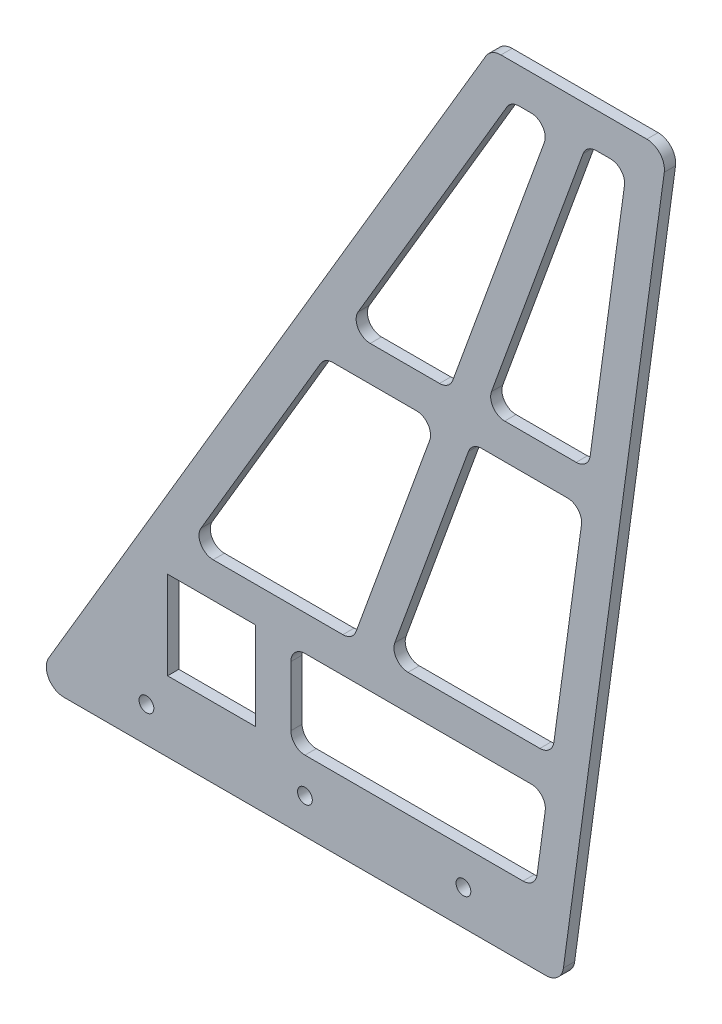
from build123d import *

# Parameters (mm, degrees)
EXTRUDE_1_DEPTH            = 3.2
FILLET_1_R                 = 5
SKETCH_2_R                 = 2.1
CUT_EXTRUDE_1_DEPTH        = 3.2
PATTERN_LINEAR_1_COUNT     = 2
PATTERN_LINEAR_1_PITCH     = 45
PATTERN_LINEAR_1_COL_COUNT = 2
PATTERN_LINEAR_1_COL_PITCH = 45
EXTRUDE_2_DEPTH            = 3.2
FILLET_2_R                 = 4


with BuildPart() as part:
    # Эскиз1 → Бобышка-Вытянуть1 (new body)
    with BuildSketch(Plane.XY):
        Polygon((0, 0), (150, 0), (180, 220), (130, 220), align=None)
        Polygon((135.706302127, 210), (23.433574854, 20), (142.634725768, 20), (168.543816677, 210), align=None, mode=Mode.SUBTRACT)
    extrude(amount=EXTRUDE_1_DEPTH)

    # Скругление1
    fillet_1_edges = [part.edges().sort_by_distance(p)[0] for p in [
        (130, 220, 1.6),
        (180, 220, 1.6),
        (150, 0, 1.6),
        (0, 0, 1.6),
    ]]
    fillet(fillet_1_edges, radius=FILLET_1_R)

    # Эскиз2 → Вырез-Вытянуть1 (cut)
    with BuildSketch(Plane.XY.offset(3.2)):
        with Locations((77.198893337, 10)):
            Circle(SKETCH_2_R)
    cut_extrude_1 = extrude(amount=-CUT_EXTRUDE_1_DEPTH, mode=Mode.SUBTRACT)

    # Линейный массив1: Вырез-Вытянуть1 ×2
    with Locations(*[(i * PATTERN_LINEAR_1_PITCH, 0, 0) for i in range(1, PATTERN_LINEAR_1_COUNT)]):
        add(cut_extrude_1, mode=Mode.SUBTRACT)

    # Линейный массив1 col: Вырез-Вытянуть1 ×2
    with Locations(*[(-i * PATTERN_LINEAR_1_COL_PITCH, 0, 0) for i in range(1, PATTERN_LINEAR_1_COL_COUNT)]):
        add(cut_extrude_1, mode=Mode.SUBTRACT)

    # Эскиз4 → Бобышка-Вытянуть2 (add)
    with BuildSketch(Plane.XY):
        Polygon((44.115393036, 55), (38.206302127, 45), (63.206302127, 45), (63.206302127, 20), (73.206302127, 20), (73.206302127, 45), (92.125059402, 45), (152.125059402, 210), (147.125059402, 210), (118.215968493, 130.5), (88.729029399, 130.5), (82.81993849, 120.5), (114.579604856, 120.5), (90.761423038, 55), align=None)
        Polygon((152.125059402, 210), (92.125059402, 45), (146.043816677, 45), (147.40745304, 55), (100.761423038, 55), (124.579604856, 120.5), (156.339271222, 120.5), (157.702907586, 130.5), (128.215968493, 130.5), (157.125059402, 210), align=None)
        Polygon((38.206302127, 45), (38.206302127, 20), (23.433574854, 20), align=None)
    extrude(amount=EXTRUDE_2_DEPTH)

    # Скругление2
    fillet_2_edges = [part.edges().sort_by_distance(p)[0] for p in [
        (147.125059402, 210, 1.6),
        (118.215968493, 130.5, 1.6),
        (88.729029399, 130.5, 1.6),
        (82.81993849, 120.5, 1.6),
        (114.579604856, 120.5, 1.6),
        (90.761423038, 55, 1.6),
        (44.115393036, 55, 1.6),
        (73.206302127, 20, 1.6),
        (168.543816677, 210, 1.6),
        (135.706302127, 210, 1.6),
        (142.634725768, 20, 1.6),
        (73.206302127, 45, 1.6),
        (146.043816677, 45, 1.6),
        (147.40745304, 55, 1.6),
        (100.761423038, 55, 1.6),
        (124.579604856, 120.5, 1.6),
        (156.339271222, 120.5, 1.6),
        (157.702907586, 130.5, 1.6),
        (128.215968493, 130.5, 1.6),
        (157.125059402, 210, 1.6),
    ]]
    fillet(fillet_2_edges, radius=FILLET_2_R)


solid = part.part
